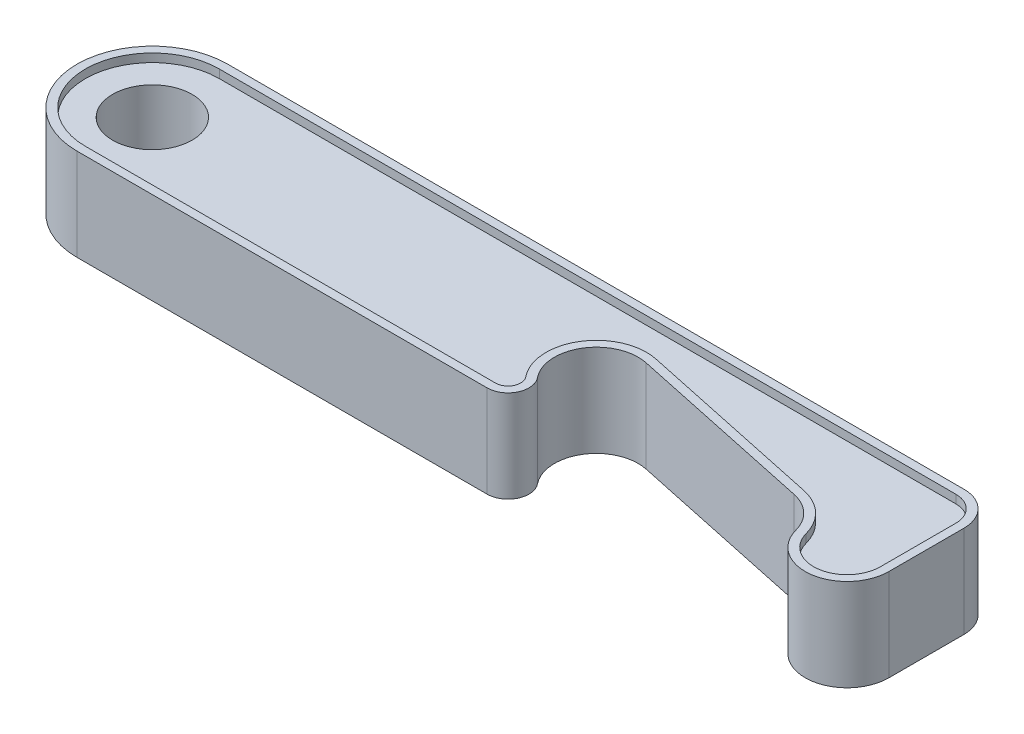
from build123d import *

# Parameters (mm, degrees)
SKETCH2_R           = 4.75
BOSS_EXTRUDE1_DEPTH = 4.5
BOSS_EXTRUDE2_DEPTH = 5.5


with BuildPart() as part:
    # Sketch2 → Boss-Extrude1 (new, symmetric)
    with BuildSketch(Plane(origin=(0, 0, 0), x_dir=(1, 0, 0), z_dir=(0, 1, 0))):
        with BuildLine():
            Line((88, 9), (0, 9))
            ThreePointArc((0, 9), (-9, 0), (0, -9))
            Line((0, -9), (49, -9))
            ThreePointArc((49, -9), (51.255135572, -7.579056787), (50.946735477, -4.93149084))
            ThreePointArc((50.946735477, -4.93149084), (50.580227318, 0.823270393), (55.879764884, 3.096265482))
            Line((55.879764884, 3.096265482), (78.377159701, -1.685703406))
            ThreePointArc((78.377159701, -1.685703406), (80.781578904, -2.951663086), (82.168800624, -5.288220705))
            ThreePointArc((82.168800624, -5.288220705), (87.649616471, -8.95762024), (92, -4))
            Line((92, -4), (92, 5))
            ThreePointArc((92, 5), (90.828427125, 7.828427125), (88, 9))
        make_face()
        Circle(SKETCH2_R, mode=Mode.SUBTRACT)
    extrude(amount=BOSS_EXTRUDE1_DEPTH, both=True)

    # Sketch2<3> → Boss-Extrude2 (add, symmetric)
    with BuildSketch(Plane(origin=(0, 0, 0), x_dir=(1, 0, 0), z_dir=(0, 1, 0))):
        with BuildLine():
            Line((88, 9), (0, 9))
            ThreePointArc((0, 9), (-9, 0), (0, -9))
            Line((0, -9), (49, -9))
            ThreePointArc((49, -9), (51.255135572, -7.579056787), (50.946735477, -4.93149084))
            ThreePointArc((50.946735477, -4.93149084), (50.580227318, 0.823270393), (55.879764884, 3.096265482))
            Line((55.879764884, 3.096265482), (78.377159701, -1.685703406))
            ThreePointArc((78.377159701, -1.685703406), (80.781578904, -2.951663086), (82.168800624, -5.288220705))
            ThreePointArc((82.168800624, -5.288220705), (87.649616471, -8.95762024), (92, -4))
            Line((92, -4), (92, 5))
            ThreePointArc((92, 5), (90.828427125, 7.828427125), (88, 9))
        make_face()
        with BuildLine():
            ThreePointArc((0, -8), (-8, 0), (0, 8))
            Line((0, 8), (88, 8))
            ThreePointArc((88, 8), (90.121320344, 7.121320344), (91, 5))
            Line((91, 5), (91, -4))
            ThreePointArc((91, -4), (87.519693176, -7.966096192), (83.135040499, -5.030576564))
            ThreePointArc((83.135040499, -5.030576564), (81.470374435, -2.226707421), (78.585071392, -0.707555806))
            Line((78.585071392, -0.707555806), (56.087676575, 4.074413083))
            ThreePointArc((56.087676575, 4.074413083), (49.728231496, 1.346818976), (50.168041286, -5.558894504))
            ThreePointArc((50.168041286, -5.558894504), (50.353081343, -7.147434072), (49, -8))
            Line((49, -8), (0, -8))
        make_face(mode=Mode.SUBTRACT)
    extrude(amount=BOSS_EXTRUDE2_DEPTH, both=True)


solid = part.part
